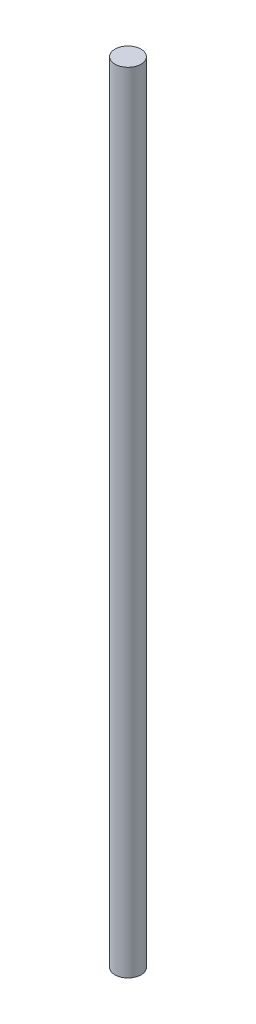
from build123d import *

# Parameters (mm, degrees)
SKETCH1_R           = 2
BOSS_EXTRUDE1_DEPTH = 60.5


with BuildPart() as part:
    # Sketch1 → Boss-Extrude1 (new, symmetric)
    with BuildSketch(Plane(origin=(0, 0, 0), x_dir=(1, 0, 0), z_dir=(0, 1, 0))):
        with Locations(Location((0, 0, 0), (0, 0, 270))):
            Circle(SKETCH1_R)
    extrude(amount=BOSS_EXTRUDE1_DEPTH, both=True)


solid = part.part
